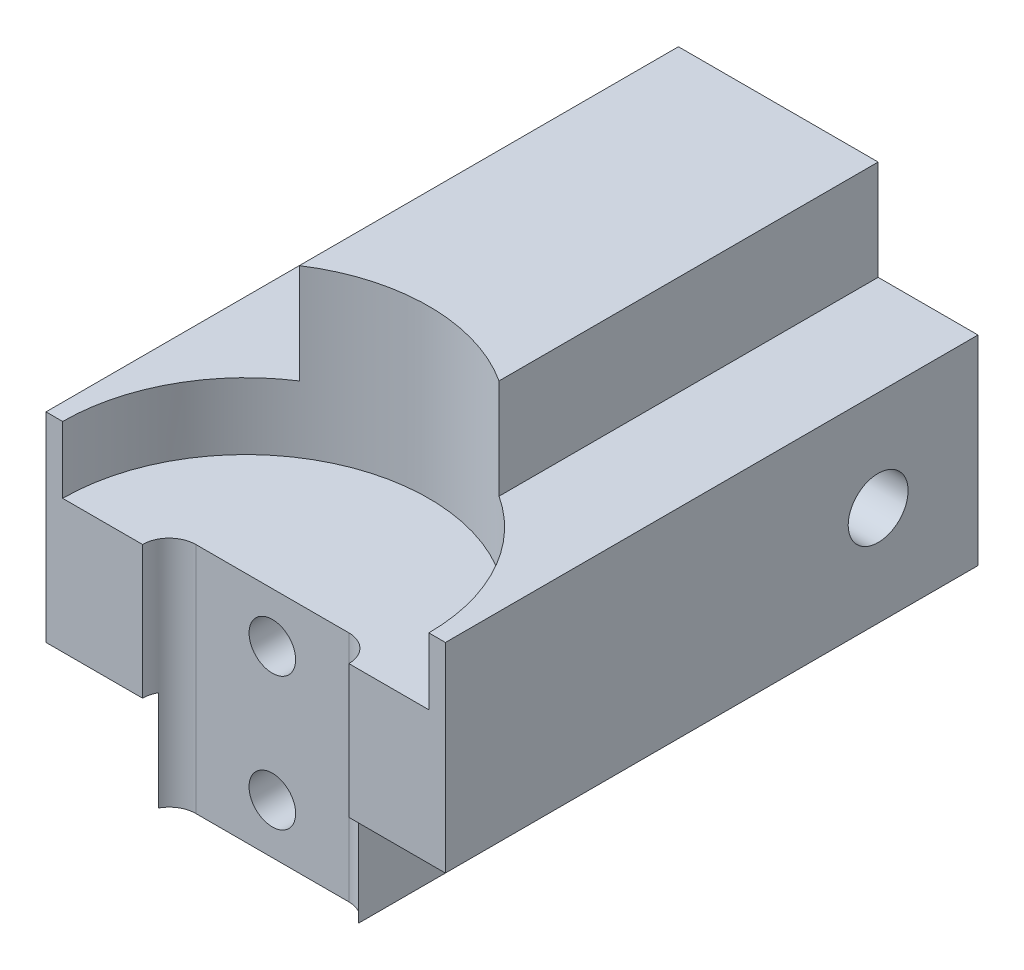
from build123d import *

# Parameters (mm, degrees)
ESTRUSIONE_ESTRUSIONE1_DEPTH = 80
SCHIZZO2_R                   = 55
TAGLIO_ESTRUSIONE1_DEPTH     = 50
TAGLIO_ESTRUSIONE2_REACH     = 124.066
FORO_18_0_18_1_D             = 18
FORO_FILETTATO_M22_1_D       = 19.5
FORO_FILETTATO_M22_1_DEPTH   = 60
FORO_FILETTATO_M22_1_TIP     = 5.858391036
FORO_FILETTATO_M16_1_D       = 14
FORO_FILETTATO_M16_1_DEPTH   = 35
FORO_FILETTATO_M16_1_TIP     = 4.206024333


with BuildPart() as part:
    # Schizzo1 → Estrusione-Estrusione1 (new, symmetric)
    with BuildSketch(Plane.XY):
        Polygon((-30, 60), (30, 60), (30, 30), (60, 30), (60, -30), (30, -30), (30, -60), (-30, -60), (-30, -30), (-60, -30), (-60, 30), (-30, 30), align=None)
    extrude(amount=ESTRUSIONE_ESTRUSIONE1_DEPTH, both=True)

    # Schizzo2 → Taglio-Estrusione1 (cut)
    with BuildSketch(Plane(origin=(0, 60, 0), x_dir=(1, 0, 0), z_dir=(0, 1, 0))):
        with Locations((0, -80)):
            Circle(SCHIZZO2_R)
    extrude(amount=-TAGLIO_ESTRUSIONE1_DEPTH, mode=Mode.SUBTRACT)

    # Schizzo3 → Taglio-Estrusione2 (cut, up to next)
    with BuildSketch(Plane(origin=(0, 10, 0), x_dir=(1, 0, 0), z_dir=(0, 1, 0)), mode=Mode.PRIVATE) as taglio_estrusione2_sk1:
        with BuildLine():
            Line((-23, -72), (23, -72))
            ThreePointArc((23, -72), (31, -80), (23, -88))
            Line((23, -88), (-23, -88))
            ThreePointArc((-23, -88), (-31, -80), (-23, -72))
        make_face()
    taglio_estrusione2_tool1 = extrude(taglio_estrusione2_sk1.sketch, amount=-TAGLIO_ESTRUSIONE2_REACH, mode=Mode.PRIVATE) & part.part
    add(taglio_estrusione2_tool1.solids().sort_by_distance((0, 10, 80))[0], mode=Mode.SUBTRACT)

    # Foro Ø18.0 (18)-1 (through all)
    with Locations(Plane.ZY.offset(60)):
        with Locations((-50, 0)):
            Hole(FORO_18_0_18_1_D / 2)

    # Foro filettato M22-1
    with Locations(Plane(origin=(0, 0, -80), x_dir=(-1, 0, 0), z_dir=(0, 0, -1))):
        with Locations((0, 0)):
            Hole(FORO_FILETTATO_M22_1_D / 2, depth=FORO_FILETTATO_M22_1_DEPTH)
            with Locations((0, 0, -(FORO_FILETTATO_M22_1_DEPTH + FORO_FILETTATO_M22_1_TIP / 2))):  # 118° drill point
                Cone(0, FORO_FILETTATO_M22_1_D / 2, FORO_FILETTATO_M22_1_TIP, mode=Mode.SUBTRACT)

    # Foro filettato M16-1
    with Locations(Plane.XY.offset(72)):
        with Locations((0, -5), (0, -45)):
            Hole(FORO_FILETTATO_M16_1_D / 2, depth=FORO_FILETTATO_M16_1_DEPTH)
            with Locations((0, 0, -(FORO_FILETTATO_M16_1_DEPTH + FORO_FILETTATO_M16_1_TIP / 2))):  # 118° drill point
                Cone(0, FORO_FILETTATO_M16_1_D / 2, FORO_FILETTATO_M16_1_TIP, mode=Mode.SUBTRACT)


solid = part.part
